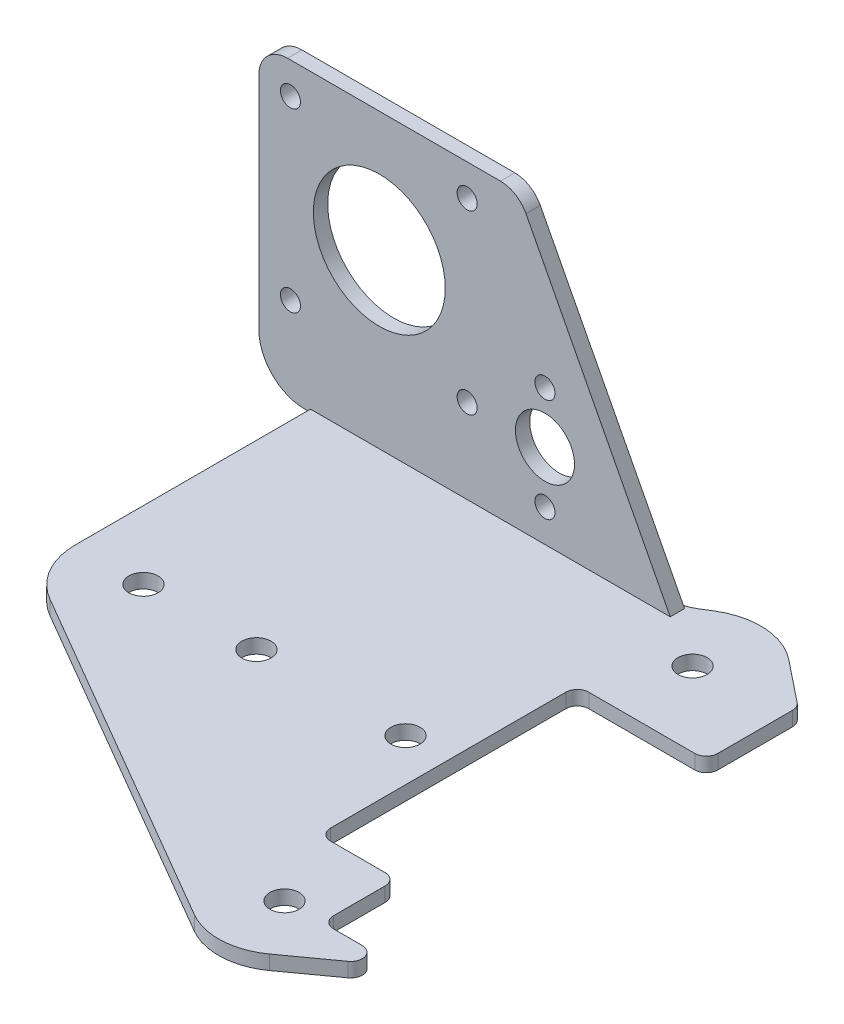
from build123d import *

# Parameters (mm, degrees)
SKETCH2_R           = 2.55
BOSS_EXTRUDE1_DEPTH = 2.5
SKETCH3_R           = 11.5
SKETCH3_R_2         = 5.15
SKETCH3_R_3         = 1.75
BOSS_EXTRUDE2_DEPTH = 2.5


with BuildPart() as part:
    # Sketch2 → Boss-Extrude1 (new body)
    with BuildSketch(Plane(origin=(0, 0, 0), x_dir=(1, 0, 0), z_dir=(0, 1, 0))):
        with BuildLine():
            Line((0, 0), (0, -43.53))
            ThreePointArc((0, -43.53), (1.597239013, -49.511852877), (5.96376064, -53.901297623))
            Line((5.96376064, -53.901297623), (66.212357085, -88.966818103))
            ThreePointArc((66.212357085, -88.966818103), (72.562868254, -90.513731665), (78.730609731, -88.350193185))
            Line((78.730609731, -88.350193185), (86.683137673, -82.606205082))
            ThreePointArc((86.683137673, -82.606205082), (87.415064266, -80.369517058), (85.51209015, -78.984894595))
            Line((85.51209015, -78.984894595), (80.51209015, -78.984894595))
            ThreePointArc((80.51209015, -78.984894595), (79.097876588, -78.399108157), (78.51209015, -76.984894595))
            Line((78.51209015, -76.984894595), (78.51209015, -67.984894595))
            ThreePointArc((78.51209015, -67.984894595), (77.926303712, -66.570681032), (76.51209015, -65.984894595))
            Line((76.51209015, -65.984894595), (67.01209015, -65.984894595))
            ThreePointArc((67.01209015, -65.984894595), (65.597876588, -65.399108157), (65.01209015, -63.984894595))
            Line((65.01209015, -63.984894595), (65.01209015, -22.984894595))
            ThreePointArc((65.01209015, -22.984894595), (65.597876588, -21.570681032), (67.01209015, -20.984894595))
            Line((67.01209015, -20.984894595), (85.51209015, -20.984894595))
            ThreePointArc((85.51209015, -20.984894595), (86.926303712, -20.399108157), (87.51209015, -18.984894595))
            Line((87.51209015, -18.984894595), (87.51209015, -5.954894595))
            ThreePointArc((87.51209015, -5.954894595), (87.314017067, -5.087104652), (86.759030766, -4.391200539))
            Line((86.759030766, -4.391200539), (79.495671877, 1.400838623))
            ThreePointArc((79.495671877, 1.400838623), (72.762340359, 3.995319432), (65.758425997, 2.25915481))
            Line((65.758425997, 2.25915481), (63.980401456, 1.173012986))
            ThreePointArc((63.980401456, 1.173012986), (61.97611448, 0.29883463), (59.81, 0))
            Line((59.81, 0), (0, 0))
        make_face()
        with Locations(Location((71.997086471, -79.027657881, 0), (0, 0, 270))):
            Circle(SKETCH2_R, mode=Mode.SUBTRACT)
        with Locations(Location((11.9, -43.53, 0), (0, 0, 270))):
            Circle(SKETCH2_R, mode=Mode.SUBTRACT)
        with Locations(Location((31.6, -43.53, 0), (0, 0, 270))):
            Circle(SKETCH2_R, mode=Mode.SUBTRACT)
        with Locations(Location((57.6, -43.53, 0), (0, 0, 270))):
            Circle(SKETCH2_R, mode=Mode.SUBTRACT)
        with Locations(Location((72.11209015, -7.984894595, 0), (0, 0, 270))):
            Circle(SKETCH2_R, mode=Mode.SUBTRACT)
    extrude(amount=BOSS_EXTRUDE1_DEPTH)

    # Sketch3 → Boss-Extrude2 (add)
    with BuildSketch(Plane.XY):
        with BuildLine():
            Line((0, 2), (-1, 2))
            ThreePointArc((-1, 2), (-6.656854249, 4.343145751), (-9, 10))
            Line((-9, 10), (-9, 48.5))
            ThreePointArc((-9, 48.5), (-7.535533906, 52.035533906), (-4, 53.5))
            Line((-4, 53.5), (8.545082445, 53.5))
            Line((8.545082445, 53.5), (17.116766662, 53.5))
            Line((17.116766662, 53.5), (33.14, 53.5))
            ThreePointArc((33.14, 53.5), (35.733493255, 52.774785695), (37.574651147, 50.809517094))
            Line((37.574651147, 50.809517094), (62.964663137, 2.056534888))
            Line((62.964663137, 2.056534888), (0, 2))
        make_face()
        with Locations((12, 32.5)):
            Circle(SKETCH3_R, mode=Mode.SUBTRACT)
        with Locations((40.884663137, 17.186715743)):
            Circle(SKETCH3_R_2, mode=Mode.SUBTRACT)
        with Locations((40.884663137, 26.186715743)):
            Circle(SKETCH3_R_3, mode=Mode.SUBTRACT)
        with Locations((40.884663137, 8.186715743)):
            Circle(SKETCH3_R_3, mode=Mode.SUBTRACT)
        with Locations((-3.5, 48)):
            Circle(SKETCH3_R_3, mode=Mode.SUBTRACT)
        with Locations((27.313284257, 48)):
            Circle(SKETCH3_R_3, mode=Mode.SUBTRACT)
        with Locations((27.313284257, 17.186715743)):
            Circle(SKETCH3_R_3, mode=Mode.SUBTRACT)
        with Locations((-3.5, 17.186715743)):
            Circle(SKETCH3_R_3, mode=Mode.SUBTRACT)
    extrude(amount=BOSS_EXTRUDE2_DEPTH)


solid = part.part
